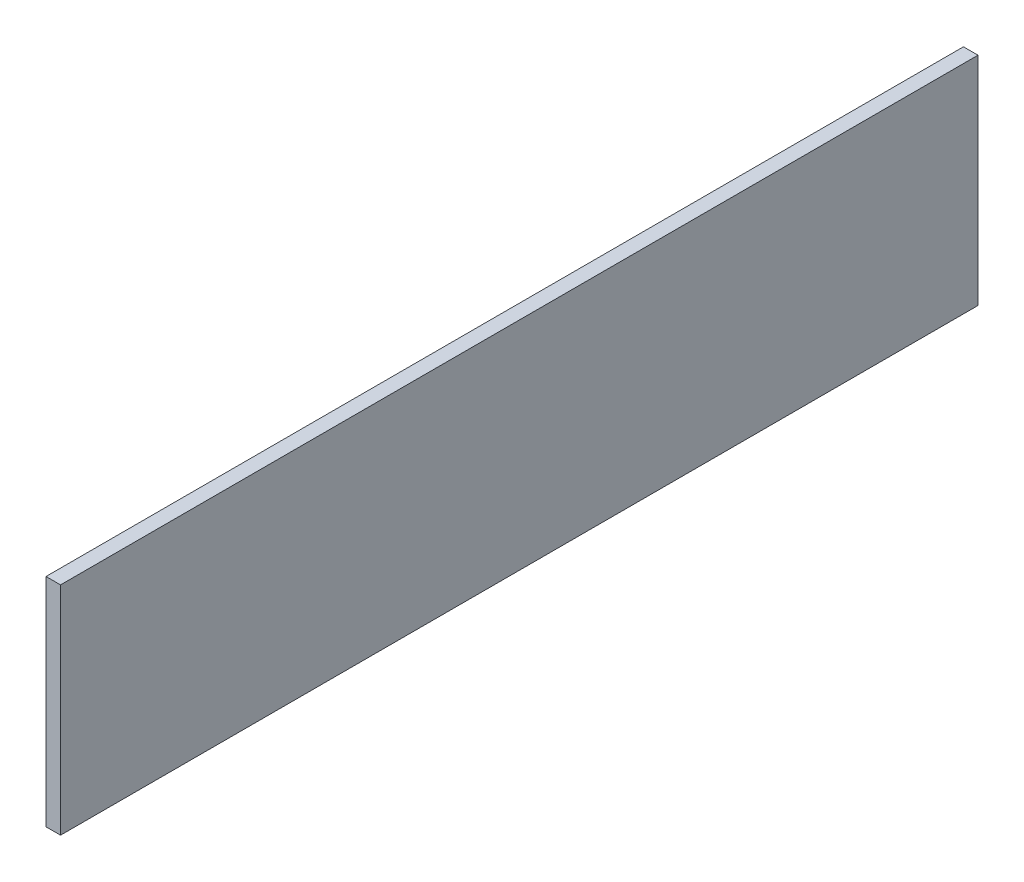
from build123d import *

# Parameters (mm, degrees)
SKETCH1_W                  = 12
SKETCH1_H                  = 179
DET_BOLME_SACI_SAG_1_DEPTH = 757.5


with BuildPart() as part:
    # Sketch1 → DET_bolme_saci_sag_1 (new body)
    with BuildSketch(Plane.XY):
        with Locations((1344, 1558.5)):
            Rectangle(SKETCH1_W, SKETCH1_H)
    extrude(amount=-DET_BOLME_SACI_SAG_1_DEPTH)


solid = part.part
